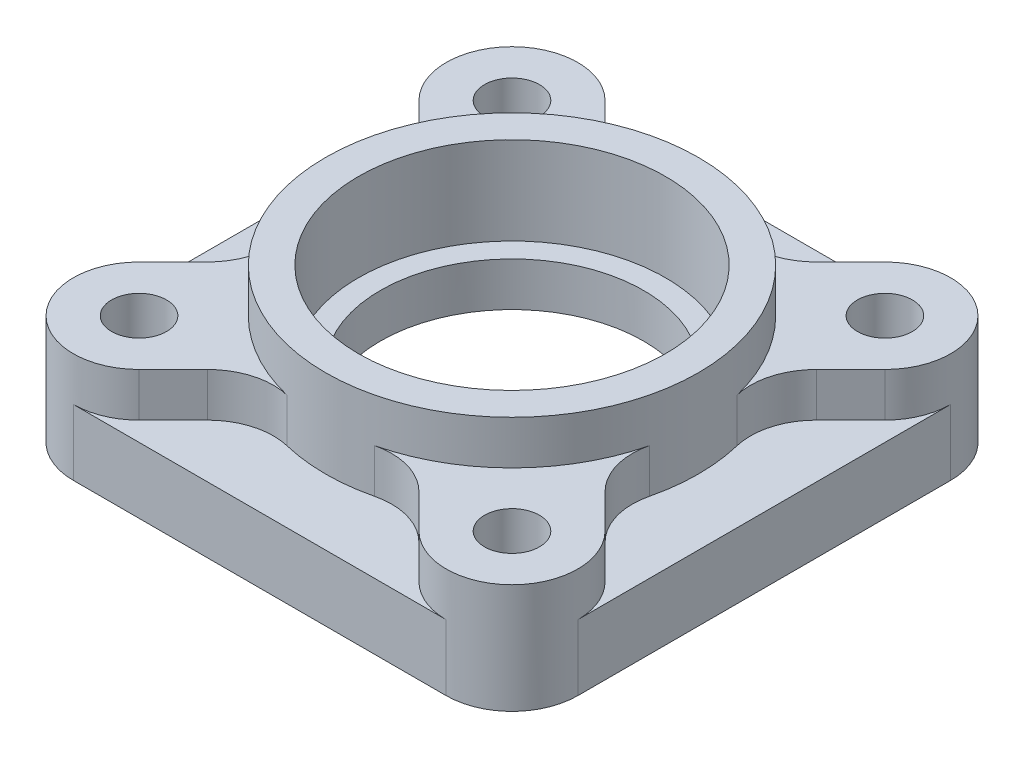
from build123d import *

# Parameters (mm, degrees)
BOSS_EXTRUDE1_DEPTH                = 9.525
SKETCH2_R                          = 26.9875
CUT_EXTRUDE1_DEPTH                 = 3.175
SKETCH3_R                          = 26.9875
BOSS_EXTRUDE2_DEPTH                = 12.7
SKETCH4_R                          = 22.225
CUT_EXTRUDE2_DEPTH                 = 12.7
SKETCH5_R                          = 19.05
CUT_EXTRUDE3_DEPTH                 = 54.175326163
F_3_16_0_1875_DIAMETER_HOLE1_D     = 4.7625
F_3_16_0_1875_DIAMETER_HOLE1_DEPTH = 4.7625
F_3_16_0_1875_DIAMETER_HOLE1_TIP   = 1.430799349
BOSS_EXTRUDE3_DEPTH                = 6.35
FILLET1_R                          = 9.525
SKETCH10_R                         = 3.9751
CUT_EXTRUDE4_DEPTH                 = 55.021670999


with BuildPart() as part:
    # Sketch1 → Boss-Extrude1 (new body)
    with BuildSketch(Plane(origin=(0, 0, 0), x_dir=(1, 0, 0), z_dir=(0, 1, 0))):
        with BuildLine():
            Line((-26.9875, -36.5125), (26.9875, -36.5125))
            ThreePointArc((26.9875, -36.5125), (33.722692091, -33.722692091), (36.5125, -26.9875))
            Line((36.5125, -26.9875), (36.5125, 26.9875))
            ThreePointArc((36.5125, 26.9875), (33.722692091, 33.722692091), (26.9875, 36.5125))
            Line((26.9875, 36.5125), (-26.9875, 36.5125))
            ThreePointArc((-26.9875, 36.5125), (-33.722692091, 33.722692091), (-36.5125, 26.9875))
            Line((-36.5125, 26.9875), (-36.5125, -26.9875))
            ThreePointArc((-36.5125, -26.9875), (-33.722692091, -33.722692091), (-26.9875, -36.5125))
        make_face()
    extrude(amount=BOSS_EXTRUDE1_DEPTH)

    # Sketch2 → Cut-Extrude1 (cut)
    with BuildSketch(Plane.XZ):
        with Locations(Location((0, 0, 0), (0, 0, 270))):
            Circle(SKETCH2_R)
    extrude(amount=-CUT_EXTRUDE1_DEPTH, mode=Mode.SUBTRACT)

    # Sketch3 → Boss-Extrude2 (add)
    with BuildSketch(Plane(origin=(0, 9.525, 0), x_dir=(1, 0, 0), z_dir=(0, 1, 0))):
        with Locations(Location((0, 0, 0), (0, 0, 90))):
            Circle(SKETCH3_R)
    extrude(amount=BOSS_EXTRUDE2_DEPTH)

    # Sketch4 → Cut-Extrude2 (cut)
    with BuildSketch(Plane(origin=(0, 22.225, 0), x_dir=(1, 0, 0), z_dir=(0, 1, 0))):
        with Locations(Location((0, 0, 0), (0, 0, 270))):
            Circle(SKETCH4_R)
    extrude(amount=-CUT_EXTRUDE2_DEPTH, mode=Mode.SUBTRACT)

    # Sketch5 → Cut-Extrude3 (cut, through all)
    with BuildSketch(Plane(origin=(0, 9.525, 0), x_dir=(1, 0, 0), z_dir=(0, 1, 0))):
        with Locations(Location((0, 0, 0), (0, 0, 270))):
            Circle(SKETCH5_R)
    extrude(amount=-CUT_EXTRUDE3_DEPTH, mode=Mode.SUBTRACT)

    # 3/16 (0.1875) Diameter Hole1
    with Locations(Plane(origin=(0, 9.525, 0), x_dir=(1, 0, 0), z_dir=(0, 1, 0))):
        with Locations((0, 31.75)):
            Hole(F_3_16_0_1875_DIAMETER_HOLE1_D / 2, depth=F_3_16_0_1875_DIAMETER_HOLE1_DEPTH)
            with Locations((0, 0, -(F_3_16_0_1875_DIAMETER_HOLE1_DEPTH + F_3_16_0_1875_DIAMETER_HOLE1_TIP / 2))):  # 118° drill point
                Cone(0, F_3_16_0_1875_DIAMETER_HOLE1_D / 2, F_3_16_0_1875_DIAMETER_HOLE1_TIP, mode=Mode.SUBTRACT)

    # Sketch9 → Boss-Extrude3 (add)
    with BuildSketch(Plane(origin=(0, 9.525, 0), x_dir=(1, 0, 0), z_dir=(0, 1, 0))):
        with BuildLine():
            ThreePointArc((-24.590156824, 11.119772642), (-19.083044257, 19.083044257), (-11.119772642, 24.590156824))
            Line((-11.119772642, 24.590156824), (-20.252307909, 33.722692091))
            ThreePointArc((-20.252307909, 33.722692091), (-23.342440307, 35.787452547), (-26.9875, 36.5125))
            ThreePointArc((-26.9875, 36.5125), (-33.722692091, 33.722692091), (-36.5125, 26.9875))
            ThreePointArc((-36.5125, 26.9875), (-35.787452547, 23.342440307), (-33.722692091, 20.252307909))
            Line((-33.722692091, 20.252307909), (-24.590156824, 11.119772642))
        make_face()
        with BuildLine():
            ThreePointArc((11.119772642, 24.590156824), (19.083044257, 19.083044257), (24.590156824, 11.119772642))
            Line((24.590156824, 11.119772642), (33.722692091, 20.252307909))
            ThreePointArc((33.722692091, 20.252307909), (35.787452547, 23.342440307), (36.5125, 26.9875))
            ThreePointArc((36.5125, 26.9875), (33.722692091, 33.722692091), (26.9875, 36.5125))
            ThreePointArc((26.9875, 36.5125), (23.342440307, 35.787452547), (20.252307909, 33.722692091))
            Line((20.252307909, 33.722692091), (11.119772642, 24.590156824))
        make_face()
        with BuildLine():
            Line((33.722692091, -20.252307909), (24.590156824, -11.119772642))
            ThreePointArc((24.590156824, -11.119772642), (19.083044257, -19.083044257), (11.119772642, -24.590156824))
            Line((11.119772642, -24.590156824), (20.252307909, -33.722692091))
            ThreePointArc((20.252307909, -33.722692091), (23.342440307, -35.787452547), (26.9875, -36.5125))
            ThreePointArc((26.9875, -36.5125), (33.722692091, -33.722692091), (36.5125, -26.9875))
            ThreePointArc((36.5125, -26.9875), (35.787452547, -23.342440307), (33.722692091, -20.252307909))
        make_face()
        with BuildLine():
            Line((-20.252307909, -33.722692091), (-11.119772642, -24.590156824))
            ThreePointArc((-11.119772642, -24.590156824), (-19.083044257, -19.083044257), (-24.590156824, -11.119772642))
            Line((-24.590156824, -11.119772642), (-33.722692091, -20.252307909))
            ThreePointArc((-33.722692091, -20.252307909), (-35.787452547, -23.342440307), (-36.5125, -26.9875))
            ThreePointArc((-36.5125, -26.9875), (-33.722692091, -33.722692091), (-26.9875, -36.5125))
            ThreePointArc((-26.9875, -36.5125), (-23.342440307, -35.787452547), (-20.252307909, -33.722692091))
        make_face()
    extrude(amount=BOSS_EXTRUDE3_DEPTH)

    # Fillet1
    fillet1_edges = [part.edges().sort_by_distance(p)[0] for p in [
        (24.590156824, 12.7, 11.119772642),
        (11.119772642, 12.7, 24.590156824),
        (-11.119772642, 12.7, 24.590156824),
        (-24.590156824, 12.7, 11.119772642),
        (-11.119772642, 12.7, -24.590156824),
        (-24.590156824, 12.7, -11.119772642),
        (24.590156824, 12.7, -11.119772642),
        (11.119772642, 12.7, -24.590156824),
    ]]
    fillet(fillet1_edges, radius=FILLET1_R)

    # Sketch10 → Cut-Extrude4 (cut, through all)
    with BuildSketch(Plane(origin=(0, 15.875, 0), x_dir=(1, 0, 0), z_dir=(0, 1, 0))):
        with Locations(Location((-26.9875, 26.9875, 0), (0, 0, 270))):
            Circle(SKETCH10_R)
        with Locations(Location((26.9875, 26.9875, 0), (0, 0, 270))):
            Circle(SKETCH10_R)
        with Locations(Location((26.9875, -26.9875, 0), (0, 0, 270))):
            Circle(SKETCH10_R)
        with Locations(Location((-26.9875, -26.9875, 0), (0, 0, 270))):
            Circle(SKETCH10_R)
    extrude(amount=-CUT_EXTRUDE4_DEPTH, mode=Mode.SUBTRACT)


solid = part.part
